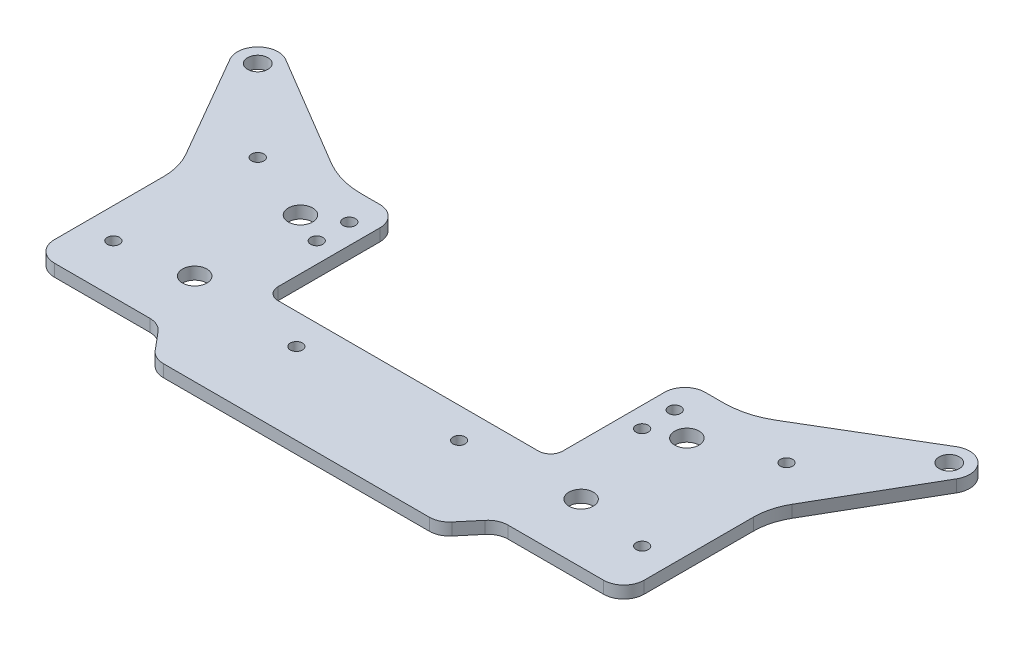
from build123d import *

# Parameters (mm, degrees)
SKETCH_1_R      = 2.5
SKETCH_1_R_2    = 3
SKETCH_1_R_3    = 1.5
EXTRUDE_1_DEPTH = 3
FILLET_1_R      = 20
FILLET_2_R      = 5


with BuildPart() as part:
    # 草图1 → 凸台-拉伸1 (new body)
    with BuildSketch(Plane(origin=(0, 0, 0), x_dir=(1, 0, 0), z_dir=(0, 1, 0))):
        with BuildLine():
            Line((-35, -15), (-35, -45))
            ThreePointArc((-35, -45), (-34.121320344, -47.121320344), (-32, -48))
            Line((-32, -48), (32, -48))
            ThreePointArc((32, -48), (34.121320344, -47.121320344), (35, -45))
            Line((35, -45), (35, -15))
            Line((35, -15), (50, -15))
            Line((50, -15), (82.444008336, 4.297313883))
            ThreePointArc((82.444008336, 4.297313883), (88.512514494, 3.558404408), (89.330127019, -2.5))
            Line((89.330127019, -2.5), (74.509618943, -28.169872981))
            ThreePointArc((74.509618943, -28.169872981), (73.011112606, -31.787587305), (72.5, -35.669872981))
            Line((72.5, -35.669872981), (72.5, -67.5))
            Line((72.5, -67.5), (41.712797049, -67.5))
            Line((41.712797049, -67.5), (35, -75.5))
            Line((35, -75.5), (-35, -75.5))
            Line((-35, -75.5), (-41.712797049, -67.5))
            Line((-41.712797049, -67.5), (-72.5, -67.5))
            Line((-72.5, -67.5), (-72.5, -35.669872981))
            ThreePointArc((-72.5, -35.669872981), (-73.011112606, -31.787587305), (-74.509618943, -28.169872981))
            Line((-74.509618943, -28.169872981), (-89.330127019, -2.5))
            ThreePointArc((-89.330127019, -2.5), (-88.512514494, 3.558404408), (-82.444008336, 4.297313883))
            Line((-82.444008336, 4.297313883), (-50, -15))
            Line((-50, -15), (-35, -15))
        make_face()
        with Locations(Location((85, 0, 0), (0, 0, 270))):
            Circle(SKETCH_1_R, mode=Mode.SUBTRACT)
        with Locations(Location((-85, 0, 0), (0, 0, 270))):
            Circle(SKETCH_1_R, mode=Mode.SUBTRACT)
        with Locations(Location((47.5, -53, 0), (0, 0, 90))):
            Circle(SKETCH_1_R_2, mode=Mode.SUBTRACT)
        with Locations(Location((-47.5, -53, 0), (0, 0, 270))):
            Circle(SKETCH_1_R_2, mode=Mode.SUBTRACT)
        with Locations(Location((20, -55.5, 0), (0, 0, 270))):
            Circle(SKETCH_1_R_3, mode=Mode.SUBTRACT)
        with Locations(Location((-20, -55.5, 0), (0, 0, 270))):
            Circle(SKETCH_1_R_3, mode=Mode.SUBTRACT)
        with Locations(Location((-65, -55.5, 0), (0, 0, 270))):
            Circle(SKETCH_1_R_3, mode=Mode.SUBTRACT)
        with Locations(Location((65, -55.5, 0), (0, 0, 270))):
            Circle(SKETCH_1_R_3, mode=Mode.SUBTRACT)
        with Locations(Location((65, -20, 0), (0, 0, 270))):
            Circle(SKETCH_1_R_3, mode=Mode.SUBTRACT)
        with Locations(Location((-65, -20, 0), (0, 0, 270))):
            Circle(SKETCH_1_R_3, mode=Mode.SUBTRACT)
        with Locations(Location((40, -22.5, 0), (0, 0, 270))):
            Circle(SKETCH_1_R_3, mode=Mode.SUBTRACT)
        with Locations(Location((40, -30.5, 0), (0, 0, 270))):
            Circle(SKETCH_1_R_3, mode=Mode.SUBTRACT)
        with Locations(Location((-47.5, -27, 0), (0, 0, 270))):
            Circle(SKETCH_1_R_2, mode=Mode.SUBTRACT)
        with Locations(Location((47.5, -27, 0), (0, 0, 90))):
            Circle(SKETCH_1_R_2, mode=Mode.SUBTRACT)
        with Locations(Location((-40, -30.5, 0), (0, 0, 90))):
            Circle(SKETCH_1_R_3, mode=Mode.SUBTRACT)
        with Locations(Location((-40, -22.5, 0), (0, 0, 90))):
            Circle(SKETCH_1_R_3, mode=Mode.SUBTRACT)
    extrude(amount=EXTRUDE_1_DEPTH)

    # 圆角1
    fillet_1_edges = [part.edges().sort_by_distance(p)[0] for p in [
        (50, 1.5, 15),
        (-50, 1.5, 15),
    ]]
    fillet(fillet_1_edges, radius=FILLET_1_R)

    # 圆角2
    fillet_2_edges = [part.edges().sort_by_distance(p)[0] for p in [
        (35, 1.5, 15),
        (72.5, 1.5, 67.5),
        (41.712797049, 1.5, 67.5),
        (35, 1.5, 75.5),
        (-35, 1.5, 75.5),
        (-41.712797049, 1.5, 67.5),
        (-72.5, 1.5, 67.5),
        (-35, 1.5, 15),
    ]]
    fillet(fillet_2_edges, radius=FILLET_2_R)


solid = part.part
